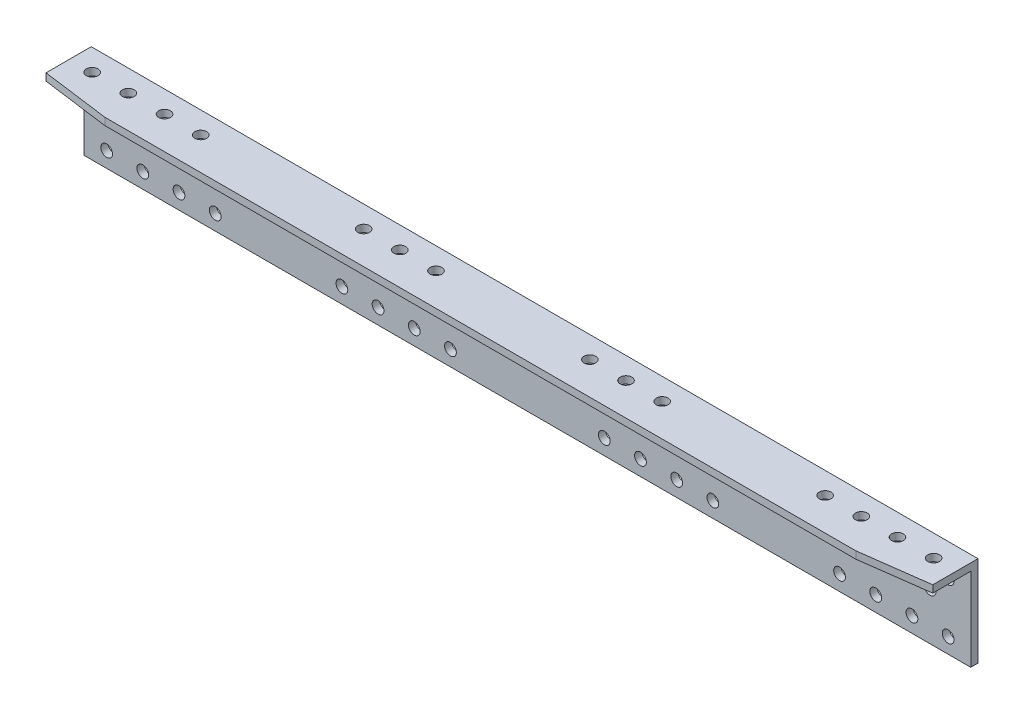
from build123d import *

# Parameters (mm, degrees)
SKETCH_1_W          = 1960
SKETCH_1_H          = 200
SKETCH_1_R          = 13
EXTRUDE_1547_DEPTH  = 16
SKETCH_2_W          = 1960
SKETCH_2_H          = 16
EXTRUDE_1_DEPTH     = 104
SKETCH_3_R          = 13
CUT_EXTRUDE_1_DEPTH = 1008.372820757


with BuildPart() as part:
    # 草图1 → Extrude 1547 (new body)
    with BuildSketch(Plane.XY):
        with Locations((0, 100)):
            Rectangle(SKETCH_1_W, SKETCH_1_H)
        with Locations((930, 146)):
            Circle(SKETCH_1_R, mode=Mode.SUBTRACT)
        with Locations(Location((-890, 106, 0), (0, 0, 180))):
            Circle(SKETCH_1_R, mode=Mode.SUBTRACT)
        with Locations((850, 146)):
            Circle(SKETCH_1_R, mode=Mode.SUBTRACT)
        with Locations((930, 34)):
            Circle(SKETCH_1_R, mode=Mode.SUBTRACT)
        with Locations((850, 34)):
            Circle(SKETCH_1_R, mode=Mode.SUBTRACT)
        with Locations(Location((-810, 106, 0), (0, 0, 180))):
            Circle(SKETCH_1_R, mode=Mode.SUBTRACT)
        with Locations((770, 34)):
            Circle(SKETCH_1_R, mode=Mode.SUBTRACT)
        with Locations((770, 146)):
            Circle(SKETCH_1_R, mode=Mode.SUBTRACT)
        with Locations(Location((-730, 106, 0), (0, 0, 180))):
            Circle(SKETCH_1_R, mode=Mode.SUBTRACT)
        with Locations((690, 146)):
            Circle(SKETCH_1_R, mode=Mode.SUBTRACT)
        with Locations((690, 34)):
            Circle(SKETCH_1_R, mode=Mode.SUBTRACT)
        with Locations(Location((-650, 106, 0), (0, 0, 180))):
            Circle(SKETCH_1_R, mode=Mode.SUBTRACT)
        with Locations(Location((170, 146, 0), (0, 0, 180))):
            Circle(SKETCH_1_R, mode=Mode.SUBTRACT)
        with Locations(Location((170, 34, 0), (0, 0, 180))):
            Circle(SKETCH_1_R, mode=Mode.SUBTRACT)
        with Locations(Location((-410, 146, 0), (0, 0, 180))):
            Circle(SKETCH_1_R, mode=Mode.SUBTRACT)
        with Locations(Location((250, 34, 0), (0, 0, 180))):
            Circle(SKETCH_1_R, mode=Mode.SUBTRACT)
        with Locations(Location((250, 146, 0), (0, 0, 180))):
            Circle(SKETCH_1_R, mode=Mode.SUBTRACT)
        with Locations(Location((-450, 106, 0), (0, 0, 180))):
            Circle(SKETCH_1_R, mode=Mode.SUBTRACT)
        with Locations(Location((330, 34, 0), (0, 0, 180))):
            Circle(SKETCH_1_R, mode=Mode.SUBTRACT)
        with Locations(Location((330, 146, 0), (0, 0, 180))):
            Circle(SKETCH_1_R, mode=Mode.SUBTRACT)
        with Locations(Location((-370, 106, 0), (0, 0, 180))):
            Circle(SKETCH_1_R, mode=Mode.SUBTRACT)
        with Locations(Location((-290, 106, 0), (0, 0, 180))):
            Circle(SKETCH_1_R, mode=Mode.SUBTRACT)
        with Locations(Location((-210, 106, 0), (0, 0, 180))):
            Circle(SKETCH_1_R, mode=Mode.SUBTRACT)
        with Locations((890, 106)):
            Circle(SKETCH_1_R, mode=Mode.SUBTRACT)
        with Locations((810, 106)):
            Circle(SKETCH_1_R, mode=Mode.SUBTRACT)
        with Locations((650, 106)):
            Circle(SKETCH_1_R, mode=Mode.SUBTRACT)
        with Locations((730, 106)):
            Circle(SKETCH_1_R, mode=Mode.SUBTRACT)
        with Locations((-330, 146)):
            Circle(SKETCH_1_R, mode=Mode.SUBTRACT)
        with Locations((-330, 34)):
            Circle(SKETCH_1_R, mode=Mode.SUBTRACT)
        with Locations((410, 146)):
            Circle(SKETCH_1_R, mode=Mode.SUBTRACT)
        with Locations((-250, 146)):
            Circle(SKETCH_1_R, mode=Mode.SUBTRACT)
        with Locations((-250, 34)):
            Circle(SKETCH_1_R, mode=Mode.SUBTRACT)
        with Locations((450, 106)):
            Circle(SKETCH_1_R, mode=Mode.SUBTRACT)
        with Locations((-170, 34)):
            Circle(SKETCH_1_R, mode=Mode.SUBTRACT)
        with Locations((-170, 146)):
            Circle(SKETCH_1_R, mode=Mode.SUBTRACT)
        with Locations((370, 106)):
            Circle(SKETCH_1_R, mode=Mode.SUBTRACT)
        with Locations(Location((-690, 146, 0), (0, 0, 180))):
            Circle(SKETCH_1_R, mode=Mode.SUBTRACT)
        with Locations((290, 106)):
            Circle(SKETCH_1_R, mode=Mode.SUBTRACT)
        with Locations(Location((-770, 146, 0), (0, 0, 180))):
            Circle(SKETCH_1_R, mode=Mode.SUBTRACT)
        with Locations((210, 106)):
            Circle(SKETCH_1_R, mode=Mode.SUBTRACT)
        with Locations(Location((-850, 146, 0), (0, 0, 180))):
            Circle(SKETCH_1_R, mode=Mode.SUBTRACT)
        with Locations((130, 106)):
            Circle(SKETCH_1_R, mode=Mode.SUBTRACT)
        with Locations(Location((-930, 146, 0), (0, 0, 180))):
            Circle(SKETCH_1_R, mode=Mode.SUBTRACT)
        with Locations(Location((-690, 34, 0), (0, 0, 180))):
            Circle(SKETCH_1_R, mode=Mode.SUBTRACT)
        with Locations(Location((-770, 34, 0), (0, 0, 180))):
            Circle(SKETCH_1_R, mode=Mode.SUBTRACT)
        with Locations(Location((-850, 34, 0), (0, 0, 180))):
            Circle(SKETCH_1_R, mode=Mode.SUBTRACT)
        with Locations(Location((-930, 34, 0), (0, 0, 180))):
            Circle(SKETCH_1_R, mode=Mode.SUBTRACT)
        with Locations(Location((-130, 106, 0), (0, 0, 180))):
            Circle(SKETCH_1_R, mode=Mode.SUBTRACT)
        with Locations((410, 34)):
            Circle(SKETCH_1_R, mode=Mode.SUBTRACT)
        with Locations(Location((-410, 34, 0), (0, 0, 180))):
            Circle(SKETCH_1_R, mode=Mode.SUBTRACT)
    extrude(amount=EXTRUDE_1547_DEPTH)

    # 草图2 → 凸台-拉伸1 (add)
    with BuildSketch(Plane.XY.offset(16)):
        with Locations((0, 192)):
            Rectangle(SKETCH_2_W, SKETCH_2_H)
    extrude(amount=EXTRUDE_1_DEPTH)

    # 草图3 → 切除-拉伸1 (cut, through all)
    with BuildSketch(Plane(origin=(0, 200, 0), x_dir=(-1, 0, 0), z_dir=(0, 1, 0))):
        with Locations(Location((-930, 48, 0), (0, 0, 90))):
            Circle(SKETCH_3_R)
        with Locations(Location((-850, 48, 0), (0, 0, 90))):
            Circle(SKETCH_3_R)
        with Locations(Location((-770, 48, 0), (0, 0, 90))):
            Circle(SKETCH_3_R)
        with Locations(Location((-690, 48, 0), (0, 0, 90))):
            Circle(SKETCH_3_R)
        with Locations(Location((-330, 48, 0), (0, 0, 90))):
            Circle(SKETCH_3_R)
        with Locations(Location((-250, 48, 0), (0, 0, 90))):
            Circle(SKETCH_3_R)
        with Locations(Location((-170, 48, 0), (0, 0, 90))):
            Circle(SKETCH_3_R)
        with Locations(Location((170, 48, 0), (0, 0, 90))):
            Circle(SKETCH_3_R)
        with Locations(Location((250, 48, 0), (0, 0, 90))):
            Circle(SKETCH_3_R)
        with Locations(Location((330, 48, 0), (0, 0, 90))):
            Circle(SKETCH_3_R)
        with Locations(Location((930, 48, 0), (0, 0, 90))):
            Circle(SKETCH_3_R)
        with Locations(Location((850, 48, 0), (0, 0, 90))):
            Circle(SKETCH_3_R)
        with Locations(Location((770, 48, 0), (0, 0, 90))):
            Circle(SKETCH_3_R)
        with Locations(Location((690, 48, 0), (0, 0, 90))):
            Circle(SKETCH_3_R)
        Polygon((-980, 100), (-830, 120), (-980, 120), align=None)
        Polygon((980, 100), (830, 120), (980, 120), align=None)
    extrude(amount=-CUT_EXTRUDE_1_DEPTH, mode=Mode.SUBTRACT)


solid = part.part
